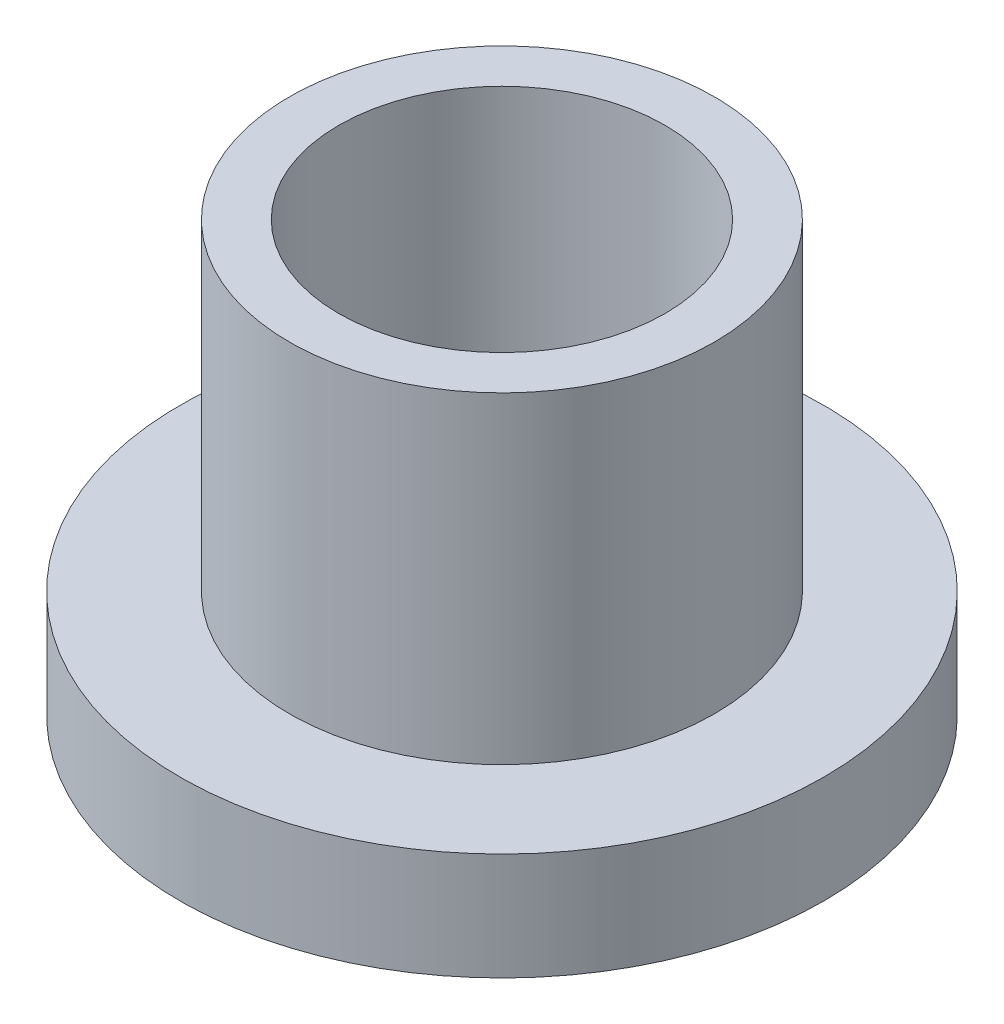
from build123d import *


with BuildPart() as part:
    # Sketch1 → Revolve1 (revolve)
    with BuildSketch(Plane.XY, mode=Mode.PRIVATE) as revolve1_sk:
        Polygon((-9.652, 0), (-9.652, 25.4), (-12.573, 25.4), (-12.573, 6.35), (-19.05, 6.35), (-19.05, 0), align=None)
    revolve(revolve1_sk.sketch.rotate(Axis((0, 0, 0), (0, 1, 0)), 180), axis=Axis((0, 0, 0), (0, 1, 0)))


solid = part.part
